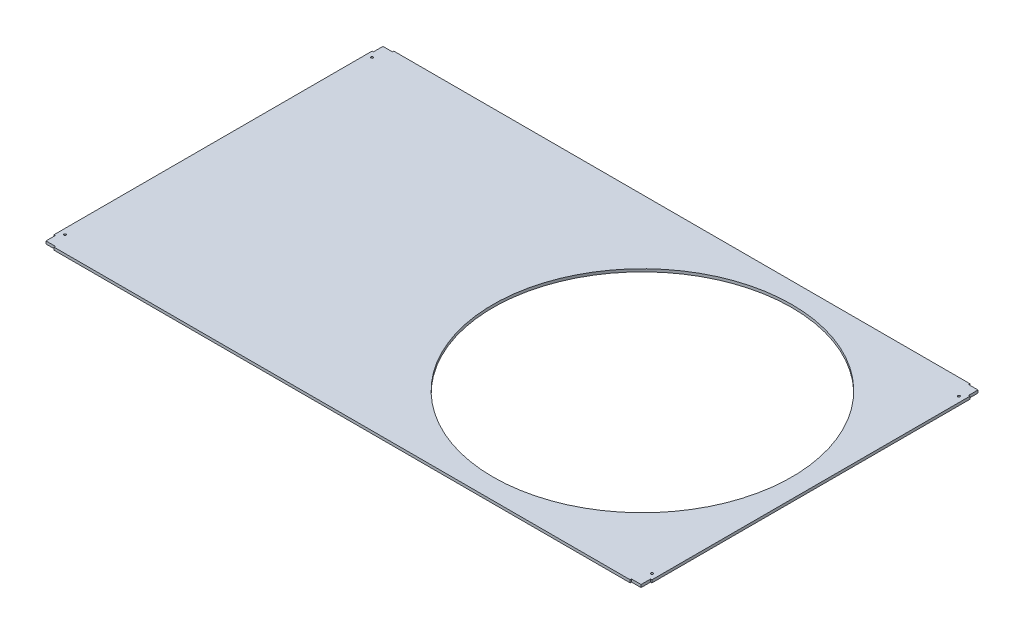
from build123d import *

# Parameters (mm, degrees)
SKETCH_1_W          = 2200
SKETCH_1_H          = 1250
SKETCH_1_R          = 550
EXTRUDE_1_DEPTH     = 10
SKETCH_2_R          = 4.05
CUT_EXTRUDE_1_DEPTH = 10
CUT_EXTRUDE_2_DEPTH = 10


with BuildPart() as part:
    # 草图1 → 凸台-拉伸1 (new body)
    with BuildSketch(Plane(origin=(0, 0, 0), x_dir=(1, 0, 0), z_dir=(0, 1, 0))):
        Rectangle(SKETCH_1_W, SKETCH_1_H)
        with Locations(Location((480, 0, 0), (0, 0, 270))):
            Circle(SKETCH_1_R, mode=Mode.SUBTRACT)
    extrude(amount=EXTRUDE_1_DEPTH)

    # 草图2 → 切除-拉伸1 (cut)
    with BuildSketch(Plane(origin=(0, 10, 0), x_dir=(1, 0, 0), z_dir=(0, 1, 0))):
        with Locations(Location((-1080, 565, 0), (0, 0, 270))):
            Circle(SKETCH_2_R)
        with Locations(Location((-1080, -565, 0), (0, 0, 270))):
            Circle(SKETCH_2_R)
        with Locations(Location((1080, -565, 0), (0, 0, 270))):
            Circle(SKETCH_2_R)
        with Locations(Location((1080, 565, 0), (0, 0, 270))):
            Circle(SKETCH_2_R)
    extrude(amount=-CUT_EXTRUDE_1_DEPTH, mode=Mode.SUBTRACT)

    # 草图3 → 切除-拉伸2 (cut)
    with BuildSketch(Plane(origin=(0, 10, 0), x_dir=(1, 0, 0), z_dir=(0, 1, 0))):
        Polygon((-1100, 625), (-1060, 625), (-1060, 620), (-1095, 620), (-1095, 585), (-1100, 585), align=None)
        Polygon((-1100, -585), (-1100, -625), (-1060, -625), (-1060, -620), (-1095, -620), (-1095, -585), align=None)
        Polygon((1100, -625), (1060, -625), (1060, -620), (1095, -620), (1095, -585), (1100, -585), align=None)
        Polygon((1100, 585), (1100, 625), (1060, 625), (1060, 620), (1095, 620), (1095, 585), align=None)
    extrude(amount=-CUT_EXTRUDE_2_DEPTH, mode=Mode.SUBTRACT)


solid = part.part
